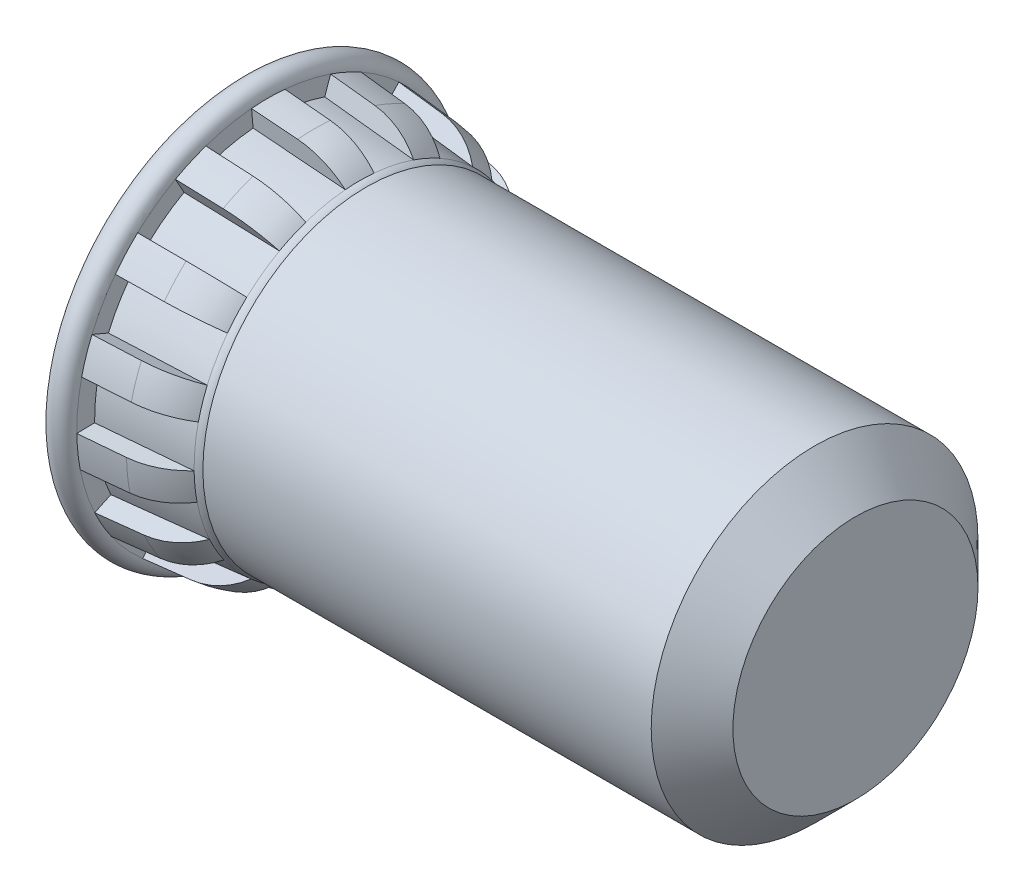
from build123d import *

# Parameters (mm, degrees)
BOSS_EXTRUDE1_START = 7.5
SKETCH2_R           = 4
BOSS_EXTRUDE1_DEPTH = 15
REVOLVE2_ANGLE      = 10
CIRPATTERN1_COUNT   = 15
CHAMFER1_SIZE       = 1


with BuildPart() as part:
    # Sketch2 → Boss-Extrude1 (new body)
    with BuildSketch(Plane(origin=(0, 0, 0), x_dir=(0, 0, -1), z_dir=(1, 0, 0)).offset(BOSS_EXTRUDE1_START)):
        Circle(SKETCH2_R)
    extrude(amount=-BOSS_EXTRUDE1_DEPTH)

    # Sketch5 → Revolve1 (revolve)
    with BuildSketch(Plane.XY, mode=Mode.PRIVATE) as revolve1_sk:
        with BuildLine():
            Line((-7.5, 0), (-7.5, 4.6875))
            ThreePointArc((-7.5, 4.6875), (-7.1875, 5), (-6.875, 4.6875))
            Line((-6.875, 4.6875), (-6.875, 4.250480209))
            Line((-6.875, 4.250480209), (-4.635765666, 4.05457259))
            ThreePointArc((-4.635765666, 4.05457259), (-4.475, 4), (-4.35759793, 3.877360198))
            Line((-4.35759793, 3.877360198), (-2.119002976, 0))
            Line((-2.119002976, 0), (-7.5, 0))
        make_face()
    revolve(revolve1_sk.sketch.rotate(Axis((-7.5, 0, 0), (1, 0, 0)), 180), axis=Axis((-7.5, 0, 0), (1, 0, 0)))

    # Sketch6 → Revolve2 (revolve, symmetric)
    with BuildSketch(Plane.XY) as revolve2_sk:
        with BuildLine():
            Line((-6.875, 4.6875), (-6.875, 0))
            Line((-6.875, 0), (-4.635765666, 0))
            Line((-4.635765666, 0), (-4.635765666, 4.05457259))
            ThreePointArc((-4.635765666, 4.05457259), (-5.147109952, 4.423487684), (-5.755382833, 4.58954619))
            Line((-5.755382833, 4.58954619), (-6.875, 4.6875))
        make_face()
    revolve(axis=Axis((-6.875, 0, 0), (1, 0, 0)), revolution_arc=REVOLVE2_ANGLE / 2)
    revolve(revolve2_sk.sketch, axis=Axis((-6.875, 0, 0), (-1, 0, 0)), revolution_arc=REVOLVE2_ANGLE / 2)

    # CirPattern1: part ×15 about axis
    cirpattern1_axis = Axis((0, 0, 0), (1, 0, 0))


with BuildPart() as part_1:
    add(part.part)
    for i in range(1, CIRPATTERN1_COUNT):
        add(part.part.rotate(cirpattern1_axis, i * 360 / CIRPATTERN1_COUNT))

    # Chamfer1
    chamfer1_edges = [part_1.edges().sort_by_distance(p)[0] for p in [
        (7.5, 0, 4),
    ]]
    chamfer(chamfer1_edges, length=CHAMFER1_SIZE)


solid = part_1.part
